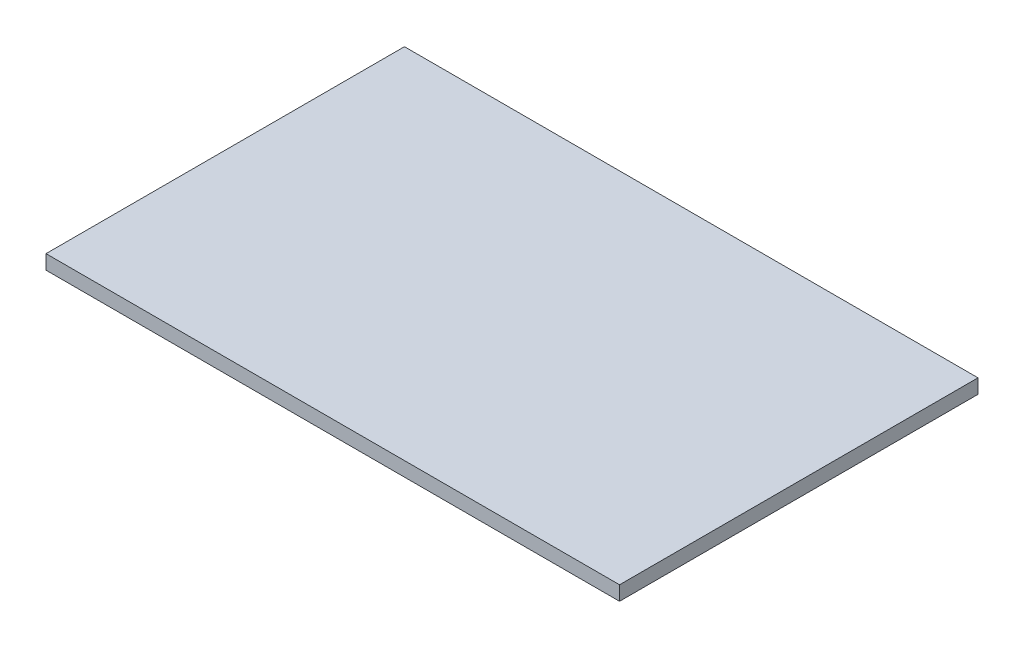
from build123d import *

# Parameters (mm, degrees)
SKETCH1_W           = 40
SKETCH1_H           = 25
BOSS_EXTRUDE1_DEPTH = 1


with BuildPart() as part:
    # Sketch1 → Boss-Extrude1 (new body)
    with BuildSketch(Plane(origin=(0, 0, 0), x_dir=(1, 0, 0), z_dir=(0, 1, 0))):
        with Locations((-2.825484765, 7.389196676)):
            Rectangle(SKETCH1_W, SKETCH1_H)
    extrude(amount=BOSS_EXTRUDE1_DEPTH)


solid = part.part
